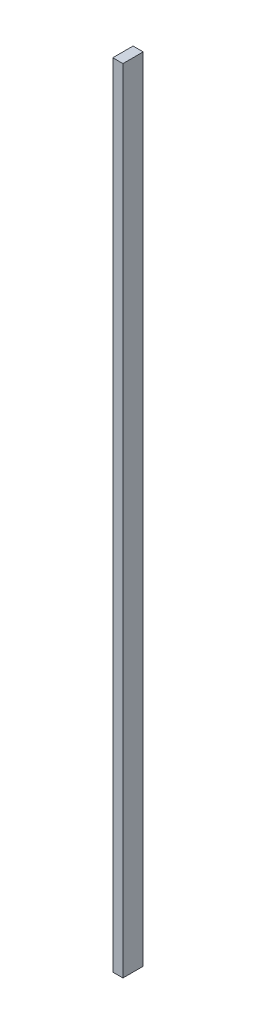
from build123d import *

# Parameters (mm, degrees)
SKETCH_1_W      = 25
SKETCH_1_H      = 50
EXTRUDE_1_DEPTH = 1950


with BuildPart() as part:
    # Эскиз1 → Бобышка-Вытянуть1 (new body)
    with BuildSketch(Plane(origin=(0, 0, 0), x_dir=(1, 0, 0), z_dir=(0, 1, 0))):
        Rectangle(SKETCH_1_W, SKETCH_1_H)
    extrude(amount=EXTRUDE_1_DEPTH)


solid = part.part
